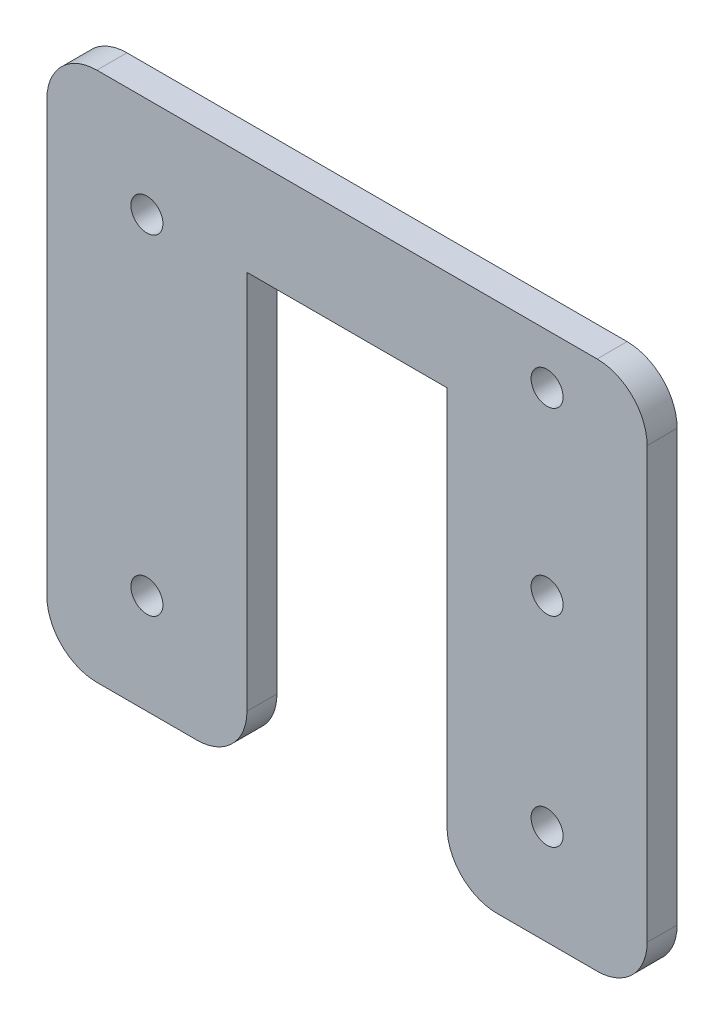
from build123d import *

# Parameters (mm, degrees)
SKETCH_1_W          = 60
SKETCH_1_H          = 53
EXTRUDE_1_DEPTH     = 3
SKETCH_2_W          = 20
SKETCH_2_H          = 43
CUT_EXTRUDE_1_DEPTH = 81.112421009
SKETCH_3_R          = 1.6
CUT_EXTRUDE_2_DEPTH = 81.112421009
SKETCH_4_R          = 1.6
CUT_EXTRUDE_3_DEPTH = 81.112421009
FILLET_1_R          = 5
SKETCH_5_R          = 1.6
CUT_EXTRUDE_4_DEPTH = 81.112421009


with BuildPart() as part:
    # 草图1 → 凸台-拉伸1 (new body)
    with BuildSketch(Plane.XY):
        with Locations((30, 26.5)):
            Rectangle(SKETCH_1_W, SKETCH_1_H)
    extrude(amount=EXTRUDE_1_DEPTH)

    # 草图2 → 切除-拉伸1 (cut, through all)
    with BuildSketch(Plane.XY.offset(3)):
        with Locations((30, 21.5)):
            Rectangle(SKETCH_2_W, SKETCH_2_H)
    extrude(amount=-CUT_EXTRUDE_1_DEPTH, mode=Mode.SUBTRACT)

    # 草图3 → 切除-拉伸2 (cut, through all)
    with BuildSketch(Plane.XY.offset(3)):
        with Locations((50, 10)):
            Circle(SKETCH_3_R)
        with Locations((50, 30)):
            Circle(SKETCH_3_R)
        with Locations((50, 48)):
            Circle(SKETCH_3_R)
    extrude(amount=-CUT_EXTRUDE_2_DEPTH, mode=Mode.SUBTRACT)

    # 草图4 → 切除-拉伸3 (cut, through all)
    with BuildSketch(Plane.XY.offset(3)):
        with Locations((10, 10)):
            Circle(SKETCH_4_R)
    extrude(amount=-CUT_EXTRUDE_3_DEPTH, mode=Mode.SUBTRACT)

    # 圆角1
    fillet_1_edges = [part.edges().sort_by_distance(p)[0] for p in [
        (20, 0, 1.5),
        (40, 0, 1.5),
        (0, 53, 1.5),
        (60, 53, 1.5),
        (60, 0, 1.5),
        (0, 0, 1.5),
    ]]
    fillet(fillet_1_edges, radius=FILLET_1_R)

    # 草图5 → 切除-拉伸4 (cut, through all)
    with BuildSketch(Plane.XY.offset(3)):
        with Locations((10, 43)):
            Circle(SKETCH_5_R)
    extrude(amount=-CUT_EXTRUDE_4_DEPTH, mode=Mode.SUBTRACT)


solid = part.part
